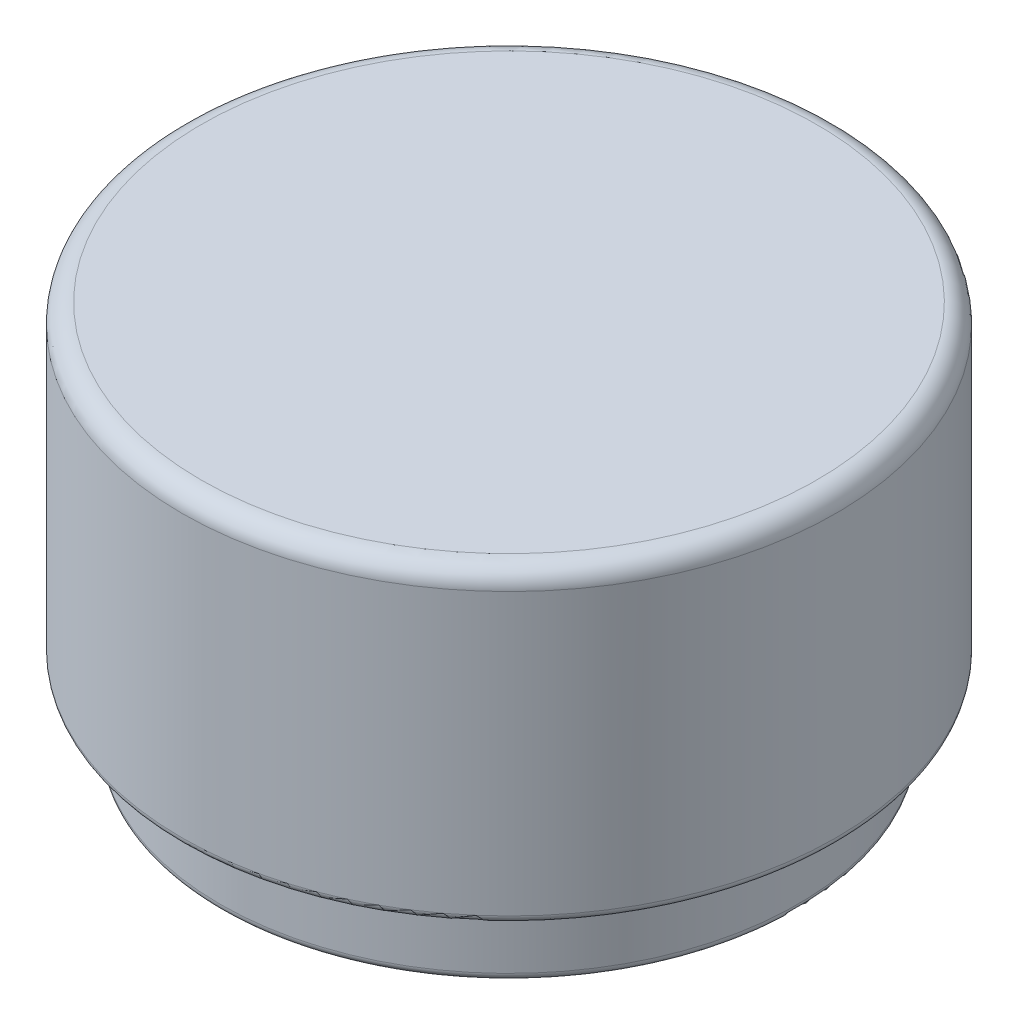
from build123d import *

# Parameters (mm, degrees)
FILLET1_R = 0.5
FILLET2_R = 0.2


with BuildPart() as part:
    # Sketch1 → Revolve1 (revolve)
    with BuildSketch(Plane(origin=(0, 0, 0), x_dir=(0, 0, -1), z_dir=(1, 0, 0))):
        Polygon((0, 0), (-8.5, 0), (-8.5, -8), (-7.5, -8), (-7.5, -10), (-7, -10), (-7, -7.5), (-8, -7.5), (-8, -0.5), (0, -0.5), align=None)
    revolve(axis=Axis((0, 0, 0), (0, -1, 0)))

    # Fillet1
    fillet1_edges = [part.edges().sort_by_distance(p)[0] for p in [
        (0, 0, -8.5),
    ]]
    fillet(fillet1_edges, radius=FILLET1_R)

    # Fillet2
    fillet2_edges = [part.edges().sort_by_distance(p)[0] for p in [
        (0, -0.5, -8),
        (0, -8, -8.5),
        (0, -10, -7.5),
        (0, -10, -7),
        (0, -7.5, -7),
    ]]
    fillet(fillet2_edges, radius=FILLET2_R)


solid = part.part
